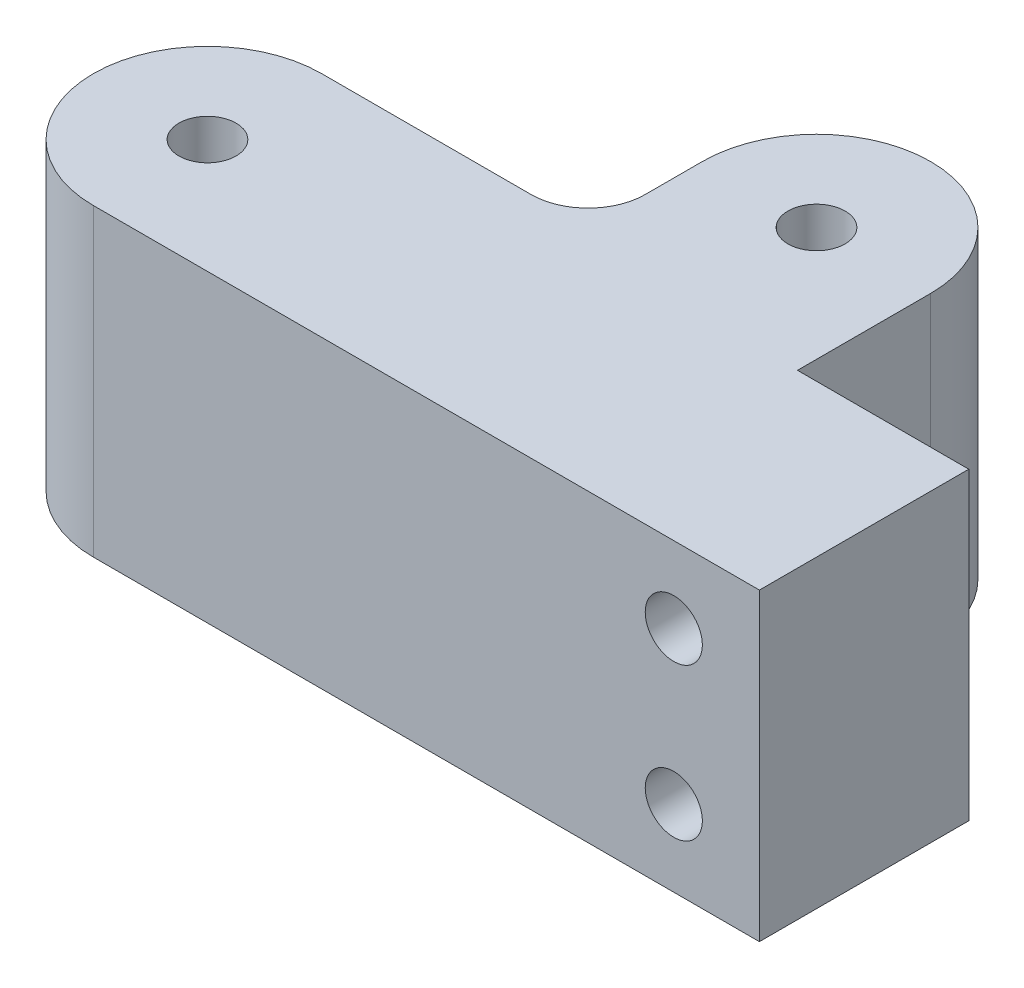
from build123d import *

# Parameters (mm, degrees)
SKETCH3_R           = 6
SKETCH3_R_2         = 1.5
BOSS_EXTRUDE1_DEPTH = 16
FILLET1_R           = 3
SKETCH4_R           = 1.5
CUT_EXTRUDE1_DEPTH  = 41.620192023


with BuildPart() as part:
    # Sketch3 → Boss-Extrude1 (new body)
    # profile 1 of 5: a face of its own
    with BuildSketch(Plane(origin=(0, 0, 0), x_dir=(1, 0, 0), z_dir=(0, 1, 0))):
        with BuildLine():
            Line((14, 12), (14, 6))
            Line((14, 6), (20, 6))
            ThreePointArc((20, 6), (15.757359313, 7.757359313), (14, 12))
        make_face()
    # profile 2 of 5: a face of its own
    with BuildSketch(Plane(origin=(0, 0, 0), x_dir=(1, 0, 0), z_dir=(0, 1, 0))):
        with Locations((20, 12)):
            Circle(SKETCH3_R)
        with Locations(Location((20, 12, 0), (0, 0, 270))):
            Circle(SKETCH3_R_2, mode=Mode.SUBTRACT)
    # profile 3 of 5: a face of its own
    with BuildSketch(Plane(origin=(0, 0, 0), x_dir=(1, 0, 0), z_dir=(0, 1, 0))):
        with BuildLine():
            Line((14, 6), (0, 6))
            ThreePointArc((0, 6), (4.242640687, 4.242640687), (6, 0))
            ThreePointArc((6, 0), (4.242640687, -4.242640687), (0, -6))
            Line((0, -6), (26, -6))
            Line((26, -6), (26, 5))
            Line((26, 5), (26, 12))
            ThreePointArc((26, 12), (24.242640687, 7.757359313), (20, 6))
            Line((20, 6), (14, 6))
        make_face()
    # profile 4 of 5: a face of its own
    with BuildSketch(Plane(origin=(0, 0, 0), x_dir=(1, 0, 0), z_dir=(0, 1, 0))):
        Circle(SKETCH3_R)
        with Locations(Location((0, 0, 0), (0, 0, 270))):
            Circle(SKETCH3_R_2, mode=Mode.SUBTRACT)
    # profile 5 of 5: a face of its own
    with BuildSketch(Plane(origin=(0, 0, 0), x_dir=(1, 0, 0), z_dir=(0, 1, 0))):
        Polygon((26, 5), (26, -6), (26.875327872, -6), (35, -6), (35, 5), align=None)
    extrude(amount=BOSS_EXTRUDE1_DEPTH)

    # Fillet1
    fillet1_edges = [part.edges().sort_by_distance(p)[0] for p in [
        (14, 8, -6),
    ]]
    fillet(fillet1_edges, radius=FILLET1_R)

    # Sketch4 → Cut-Extrude1 (cut, through all)
    with BuildSketch(Plane(origin=(0, 0, -5), x_dir=(-1, 0, 0), z_dir=(0, 0, -1))):
        with Locations((-30.5, 12)):
            Circle(SKETCH4_R)
        with Locations((-30.5, 4)):
            Circle(SKETCH4_R)
    extrude(amount=-CUT_EXTRUDE1_DEPTH, mode=Mode.SUBTRACT)


solid = part.part
